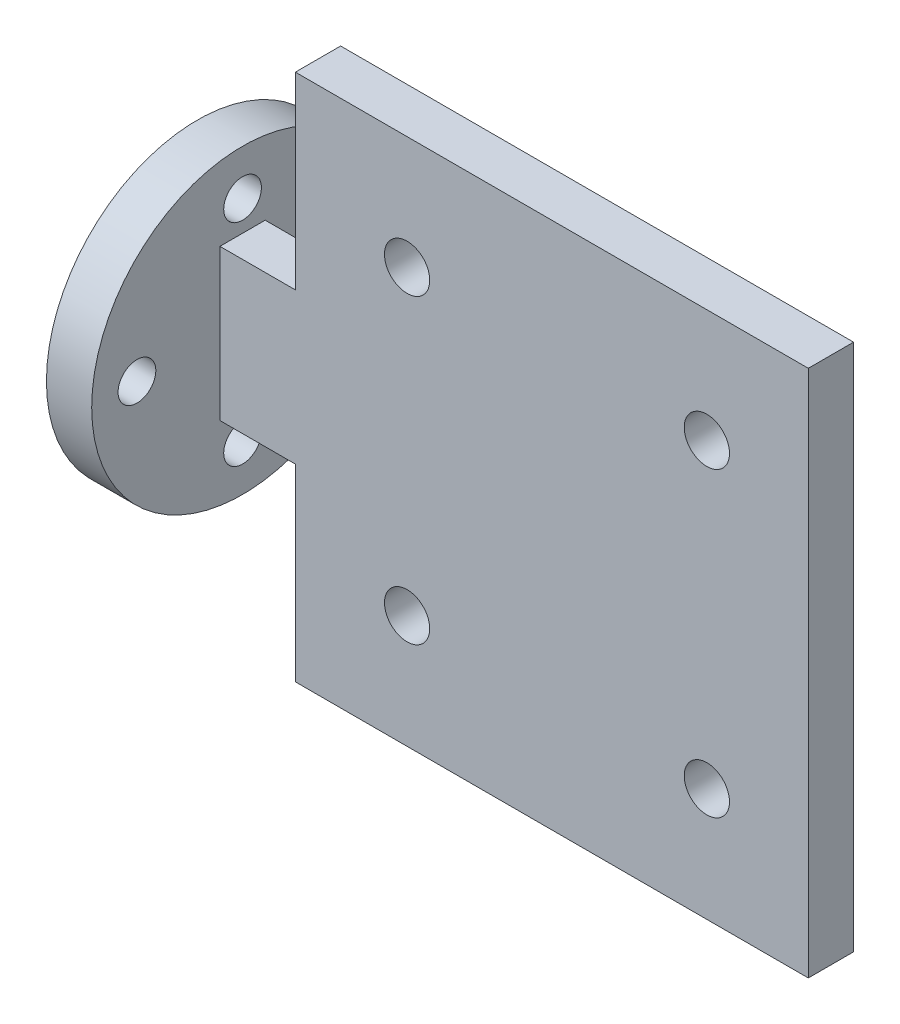
from build123d import *

# Parameters (mm, degrees)
SKETCH_1_W          = 34
SKETCH_1_H          = 35
EXTRUDE_1_DEPTH     = 3
SKETCH_2_W          = 5
SKETCH_2_H          = 5
EXTRUDE_2_DEPTH     = 3
SKETCH_3_R          = 10
EXTRUDE_3_DEPTH     = 3
SKETCH_4_R          = 1.25
CUT_EXTRUDE_1_DEPTH = 3
SKETCH_6_R          = 1.75
CUT_EXTRUDE_6_DEPTH = 1.5
SKETCH_7_R          = 1.5
CUT_EXTRUDE_7_DEPTH = 3


with BuildPart() as part:
    # 草图1 → 凸台-拉伸1 (new body)
    with BuildSketch(Plane.XY):
        Rectangle(SKETCH_1_W, SKETCH_1_H)
    extrude(amount=EXTRUDE_1_DEPTH)

    # 草图2 → 凸台-拉伸2 (add)
    with BuildSketch(Plane.XY.offset(3)):
        with Locations((-19.5, 2.5)):
            Rectangle(SKETCH_2_W, SKETCH_2_H)
        with Locations((-19.5, -2.5)):
            Rectangle(SKETCH_2_W, SKETCH_2_H)
    extrude(amount=-EXTRUDE_2_DEPTH)

    # 草图3 → 凸台-拉伸3 (add)
    with BuildSketch(Plane.ZY.offset(22)):
        with Locations((1.5, 0)):
            Circle(SKETCH_3_R)
    extrude(amount=EXTRUDE_3_DEPTH)

    # 草图4 → 切除-拉伸1 (cut)
    with BuildSketch(Plane.ZY.offset(25)):
        with Locations((1.5, 7)):
            Circle(SKETCH_4_R)
        with Locations((8.5, 0)):
            Circle(SKETCH_4_R)
        with Locations((1.5, -7)):
            Circle(SKETCH_4_R)
        with Locations((-5.5, 0)):
            Circle(SKETCH_4_R)
    extrude(amount=-CUT_EXTRUDE_1_DEPTH, mode=Mode.SUBTRACT)

    # 草图6 → 切除-拉伸6 (cut)
    with BuildSketch(Plane.ZY.offset(25)):
        with Locations((1.5, 0)):
            Circle(SKETCH_6_R)
    extrude(amount=-CUT_EXTRUDE_6_DEPTH, mode=Mode.SUBTRACT)

    # 草图7 → 切除-拉伸7 (cut)
    with BuildSketch(Plane.XY.offset(3)):
        with Locations((10.27515824, 10)):
            Circle(SKETCH_7_R)
        with Locations((10.27515824, -10)):
            Circle(SKETCH_7_R)
        with Locations((-9.593631375, 10)):
            Circle(SKETCH_7_R)
        with Locations((-9.593631375, -10)):
            Circle(SKETCH_7_R)
    extrude(amount=-CUT_EXTRUDE_7_DEPTH, mode=Mode.SUBTRACT)


solid = part.part
